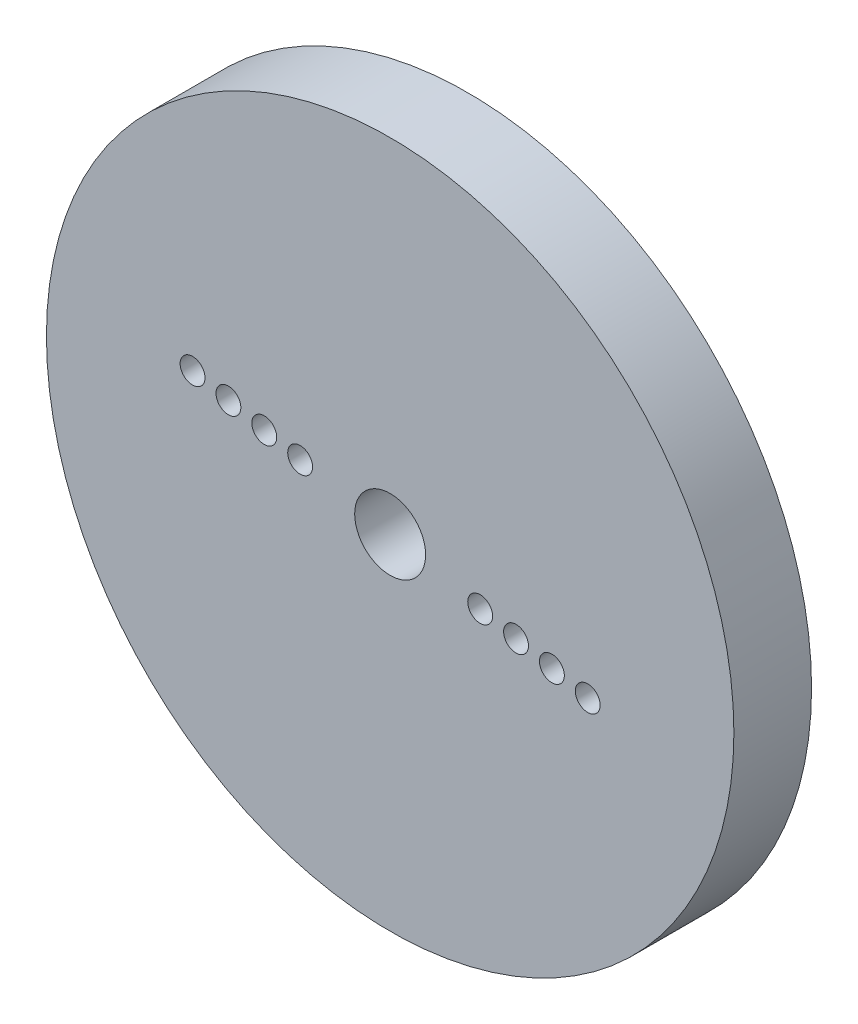
from build123d import *

# Parameters (mm, degrees)
SKETCH1_R           = 28.097988
BOSS_EXTRUDE1_DEPTH = 6.35
SKETCH2_R           = 1.016
SKETCH2_R_2         = 2.9
CUT_EXTRUDE1_DEPTH  = 6.35


with BuildPart() as part:
    # Sketch1 → Boss-Extrude1 (new body)
    with BuildSketch(Plane.XY):
        Circle(SKETCH1_R)
    extrude(amount=BOSS_EXTRUDE1_DEPTH)

    # Sketch2 → Cut-Extrude1 (cut)
    with BuildSketch(Plane(origin=(0, 0, 0), x_dir=(-1, 0, 0), z_dir=(0, 0, -1))):
        with Locations((-13.220714373, -2.876388616)):
            Circle(SKETCH2_R)
        with Locations((-16.152136629, -3.514168797)):
            Circle(SKETCH2_R)
        with Locations((-10.289292117, -2.238608435)):
            Circle(SKETCH2_R)
        with Locations((-7.357869862, -1.600828254)):
            Circle(SKETCH2_R)
        with Locations((7.357869862, 1.600828254)):
            Circle(SKETCH2_R)
        with Locations((10.289292117, 2.238608435)):
            Circle(SKETCH2_R)
        with Locations((13.220714373, 2.876388616)):
            Circle(SKETCH2_R)
        with Locations((16.152136629, 3.514168797)):
            Circle(SKETCH2_R)
        Circle(SKETCH2_R_2)
    extrude(amount=-CUT_EXTRUDE1_DEPTH, mode=Mode.SUBTRACT)


solid = part.part
